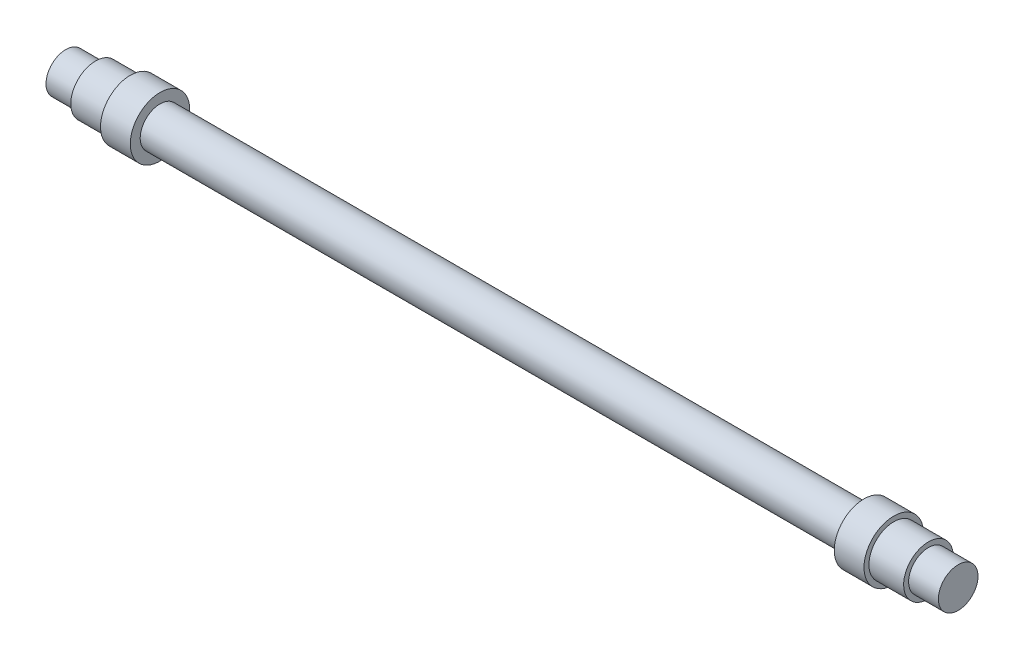
from build123d import *


with BuildPart() as part:
    # Sketch1 → Revolve1 (revolve)
    with BuildSketch(Plane.XY):
        Polygon((0, 0), (0, 2), (3, 2), (3, 2.5), (6.5, 2.5), (6.5, 3), (9.5, 3), (9.5, 2), (80.5, 2), (80.5, 3), (83.5, 3), (83.5, 2.5), (87, 2.5), (87, 2), (90, 2), (90, 0), align=None)
    revolve(axis=Axis((90, 0, 0), (-1, 0, 0)))


solid = part.part
